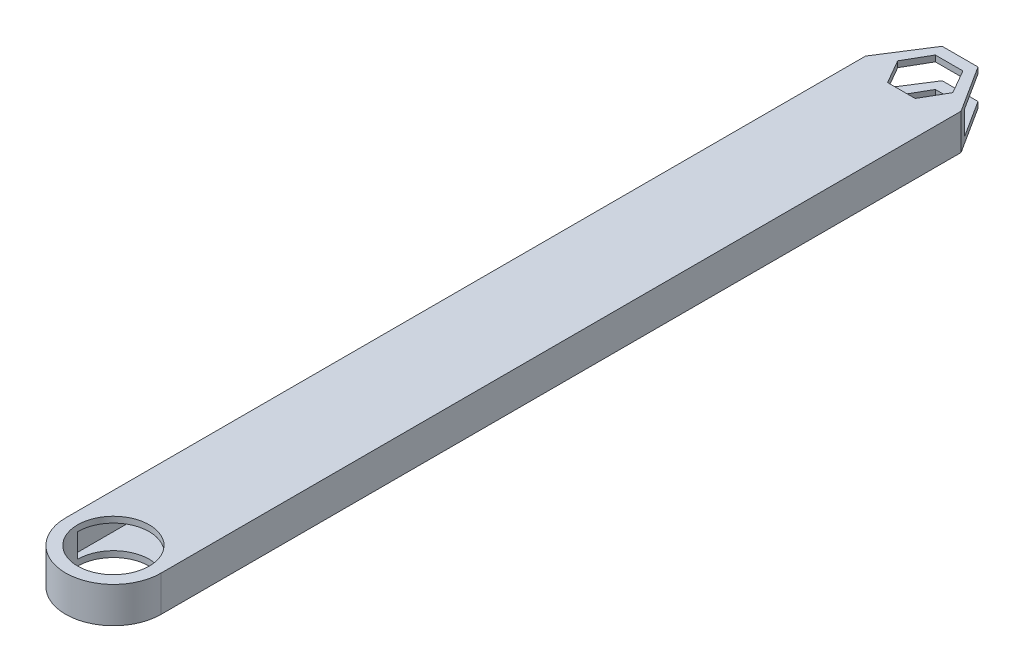
from build123d import *

# Parameters (mm, degrees)
SKETCH1_W           = 25.4
SKETCH1_H           = 9.525
BOSS_EXTRUDE1_DEPTH = 228.6
SKETCH2_W           = 22.225
SKETCH2_H           = 6.35
CUT_EXTRUDE1_DEPTH  = 231.203921828
CUT_EXTRUDE2_DEPTH  = 231.203921828
CUT_EXTRUDE3_DEPTH  = 231.203921828
BOSS_EXTRUDE2_DEPTH = 9.525
SKETCH6_R           = 9.525
CUT_EXTRUDE4_DEPTH  = 9.525


with BuildPart() as part:
    # Sketch1 → Boss-Extrude1 (new body)
    with BuildSketch(Plane.XY):
        with Locations((12.7, 4.7625)):
            Rectangle(SKETCH1_W, SKETCH1_H)
    extrude(amount=BOSS_EXTRUDE1_DEPTH)

    # Sketch2 → Cut-Extrude1 (cut, through all)
    with BuildSketch(Plane.XY.offset(228.6)):
        with Locations((12.7, 4.7625)):
            Rectangle(SKETCH2_W, SKETCH2_H)
    extrude(amount=-CUT_EXTRUDE1_DEPTH, mode=Mode.SUBTRACT)

    # Sketch3 → Cut-Extrude2 (cut, through all)
    with BuildSketch(Plane.XZ):
        Polygon((20.032348419, 12.7), (16.366174209, 19.05), (9.033825791, 19.05), (5.367651581, 12.7), (9.033825791, 6.35), (16.366174209, 6.35), align=None)
    extrude(amount=-CUT_EXTRUDE2_DEPTH, mode=Mode.SUBTRACT)

    # Sketch4 → Cut-Extrude3 (cut, through all)
    with BuildSketch(Plane(origin=(0, 9.525, 0), x_dir=(1, 0, 0), z_dir=(0, 1, 0))):
        Polygon((25.4, -15.875), (17.4625, -3.432478139), (7.9375, -3.432478139), (0, -15.875), (0, 0), (25.4, 0), align=None)
    extrude(amount=-CUT_EXTRUDE3_DEPTH, mode=Mode.SUBTRACT)

    # Sketch5 → Boss-Extrude2 (add)
    with BuildSketch(Plane(origin=(0, 9.525, 0), x_dir=(1, 0, 0), z_dir=(0, 1, 0))):
        with BuildLine():
            Line((0, -228.6), (25.4, -228.6))
            ThreePointArc((25.4, -228.6), (12.7, -241.3), (0, -228.6))
        make_face()
    extrude(amount=-BOSS_EXTRUDE2_DEPTH)

    # Sketch6 → Cut-Extrude4 (cut)
    with BuildSketch(Plane(origin=(0, 9.525, 0), x_dir=(1, 0, 0), z_dir=(0, 1, 0))):
        with Locations(Location((12.7, -228.6, 0), (0, 0, 270))):
            Circle(SKETCH6_R)
    extrude(amount=-CUT_EXTRUDE4_DEPTH, mode=Mode.SUBTRACT)


solid = part.part
